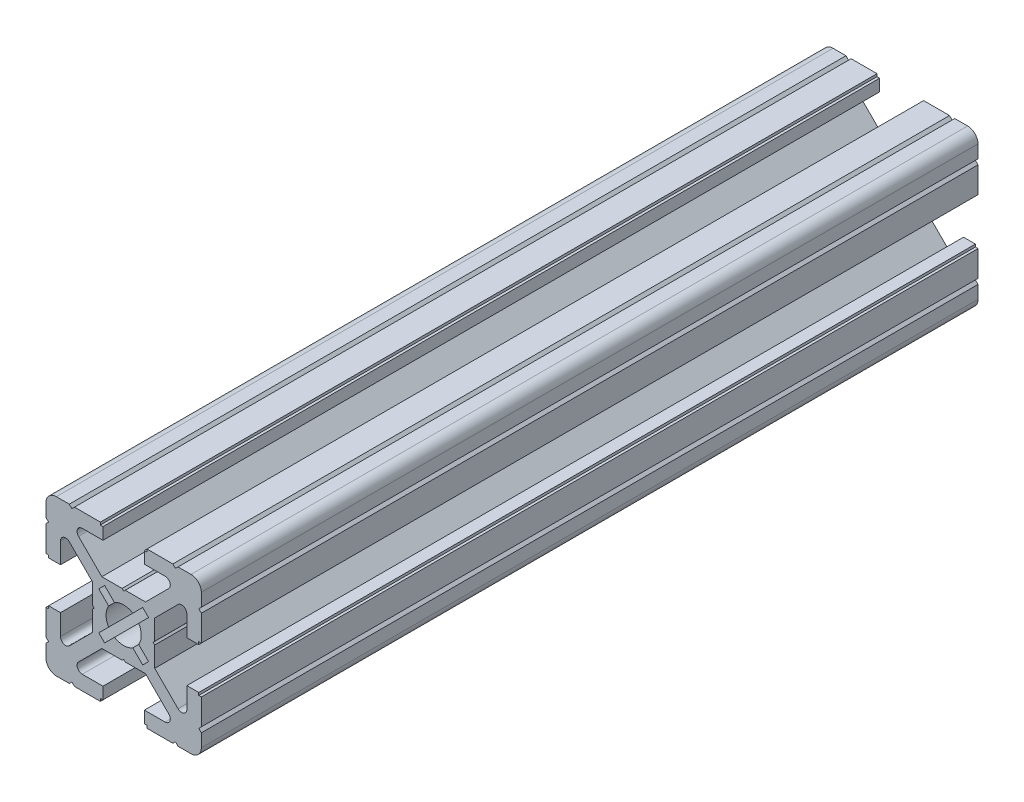
from build123d import *

# Parameters (mm, degrees)
BOSS_EXTRUDE1_DEPTH = 150


with BuildPart() as part:
    # Sketch1 → Boss-Extrude1 (new body)
    with BuildSketch(Plane.XY):
        with BuildLine():
            Line((12.999999999, 14.999999999), (10.499999999, 14.999999999))
            Line((10.499999999, 14.999999999), (9.999999999, 14.499999999))
            Line((9.999999999, 14.499999999), (9.5, 14.999999999))
            Line((9.5, 14.999999999), (4.5, 14.999999999))
            Line((4.5, 14.999999999), (4.5, 14.5))
            Line((4.5, 14.5), (4, 14.5))
            Line((4, 14.5), (4, 12.200000005))
            Line((4, 12.200000005), (7.999999994, 12.200000005))
            ThreePointArc((7.999999994, 12.200000005), (8.923879532, 11.582683434), (8.707106779, 10.492893215))
            Line((8.707106779, 10.492893215), (4.214213564, 6))
            Line((4.214213564, 6), (0.312520901, 6))
            Line((0.312520901, 6), (0, 5.7))
            Line((0, 5.7), (-0.312520903, 6))
            Line((-0.312520903, 6), (-4.214213564, 6))
            Line((-4.214213564, 6), (-8.70710678, 10.492893215))
            ThreePointArc((-8.70710678, 10.492893215), (-8.923879532, 11.582683434), (-7.999999995, 12.200000005))
            Line((-7.999999995, 12.200000005), (-4, 12.200000005))
            Line((-4, 12.200000005), (-4, 14.5))
            Line((-4, 14.5), (-4.5, 14.5))
            Line((-4.5, 14.5), (-4.5, 14.999999999))
            Line((-4.5, 14.999999999), (-9.500000003, 14.999999999))
            Line((-9.500000003, 14.999999999), (-10.000000002, 14.499999999))
            Line((-10.000000002, 14.499999999), (-10.500000001, 14.999999999))
            Line((-10.500000001, 14.999999999), (-13, 14.999999999))
            ThreePointArc((-13, 14.999999999), (-14.414213562, 14.414213561), (-15, 12.999999999))
            Line((-15, 12.999999999), (-15, 10.5))
            Line((-15, 10.5), (-14.500000001, 10.000000001))
            Line((-14.500000001, 10.000000001), (-15, 9.500000001))
            Line((-15, 9.500000001), (-15, 4.5))
            Line((-15, 4.5), (-14.5, 4.5))
            Line((-14.5, 4.5), (-14.5, 4))
            Line((-14.5, 4), (-12.200000005, 4))
            Line((-12.200000005, 4), (-12.200000005, 7.999999994))
            ThreePointArc((-12.200000005, 7.999999994), (-11.582683434, 8.923879532), (-10.492893215, 8.707106779))
            Line((-10.492893215, 8.707106779), (-6, 4.214213564))
            Line((-6, 4.214213564), (-6, 0.312520901))
            Line((-6, 0.312520901), (-5.7, 0))
            Line((-5.7, 0), (-6, -0.312520903))
            Line((-6, -0.312520903), (-6, -4.214213564))
            Line((-6, -4.214213564), (-10.492893215, -8.70710678))
            ThreePointArc((-10.492893215, -8.70710678), (-11.582683434, -8.923879532), (-12.200000005, -7.999999995))
            Line((-12.200000005, -7.999999995), (-12.200000005, -4))
            Line((-12.200000005, -4), (-14.5, -4))
            Line((-14.5, -4), (-14.5, -4.5))
            Line((-14.5, -4.5), (-15, -4.5))
            Line((-15, -4.5), (-15, -9.500000001))
            Line((-15, -9.500000001), (-14.500000001, -10.000000001))
            Line((-14.500000001, -10.000000001), (-15, -10.5))
            Line((-15, -10.5), (-15, -13))
            ThreePointArc((-15, -13), (-14.414213562, -14.414213562), (-13, -15))
            Line((-13, -15), (-10.489897949, -15))
            Line((-10.489897949, -15), (-9.989897949, -14.5))
            Line((-9.989897949, -14.5), (-9.500000001, -15))
            Line((-9.500000001, -15), (-4.5, -15))
            Line((-4.5, -15), (-4.5, -14.5))
            Line((-4.5, -14.5), (-4, -14.5))
            Line((-4, -14.5), (-4, -12.200000005))
            Line((-4, -12.200000005), (-7.999999995, -12.200000005))
            ThreePointArc((-7.999999995, -12.200000005), (-8.923879532, -11.582683434), (-8.70710678, -10.492893215))
            Line((-8.70710678, -10.492893215), (-4.214213564, -6))
            Line((-4.214213564, -6), (-0.312520901, -6))
            Line((-0.312520901, -6), (0, -5.7))
            Line((0, -5.7), (0.312520903, -6))
            Line((0.312520903, -6), (4.214213564, -6))
            Line((4.214213564, -6), (8.70710678, -10.492893215))
            ThreePointArc((8.70710678, -10.492893215), (8.923879532, -11.582683434), (7.999999995, -12.200000005))
            Line((7.999999995, -12.200000005), (4, -12.200000005))
            Line((4, -12.200000005), (4, -14.5))
            Line((4, -14.5), (4.5, -14.5))
            Line((4.5, -14.5), (4.5, -15))
            Line((4.5, -15), (9.500000001, -15))
            Line((9.500000001, -15), (10.000000001, -14.500000001))
            Line((10.000000001, -14.500000001), (10.5, -15))
            Line((10.5, -15), (12.999999999, -15))
            ThreePointArc((12.999999999, -15), (14.414213561, -14.414213562), (14.999999999, -13))
            Line((14.999999999, -13), (14.999999999, -10.500000001))
            Line((14.999999999, -10.500000001), (14.499999999, -10.000000002))
            Line((14.499999999, -10.000000002), (14.999999999, -9.500000002))
            Line((14.999999999, -9.500000002), (14.999999999, -4.5))
            Line((14.999999999, -4.5), (14.5, -4.5))
            Line((14.5, -4.5), (14.5, -4))
            Line((14.5, -4), (12.200000005, -4))
            Line((12.200000005, -4), (12.200000005, -7.999999995))
            ThreePointArc((12.200000005, -7.999999995), (11.582683434, -8.923879532), (10.492893215, -8.70710678))
            Line((10.492893215, -8.70710678), (6, -4.214213564))
            Line((6, -4.214213564), (6, -0.312520901))
            Line((6, -0.312520901), (5.7, 0))
            Line((5.7, 0), (6, 0.312520903))
            Line((6, 0.312520903), (6, 4.214213564))
            Line((6, 4.214213564), (10.492893215, 8.70710678))
            ThreePointArc((10.492893215, 8.70710678), (11.582683434, 8.923879532), (12.200000005, 7.999999995))
            Line((12.200000005, 7.999999995), (12.200000005, 4))
            Line((12.200000005, 4), (14.5, 4))
            Line((14.5, 4), (14.5, 4.5))
            Line((14.5, 4.5), (14.999999999, 4.5))
            Line((14.999999999, 4.5), (14.999999999, 9.5))
            Line((14.999999999, 9.5), (14.499999999, 9.999999999))
            Line((14.499999999, 9.999999999), (14.999999999, 10.499999999))
            Line((14.999999999, 10.499999999), (14.999999999, 12.999999999))
            ThreePointArc((14.999999999, 12.999999999), (14.414213561, 14.414213561), (12.999999999, 14.999999999))
        make_face()
        with BuildLine():
            Line((-2.902349714, 1.770978864), (-4.808326112, 3.676955262))
            Line((-4.808326112, 3.676955262), (-3.676955262, 4.808326112))
            Line((-3.676955262, 4.808326112), (-1.770978864, 2.902349714))
            ThreePointArc((-1.770978864, 2.902349714), (0, 3.4), (1.770978864, 2.902349714))
            Line((1.770978864, 2.902349714), (3.676955262, 4.808326112))
            Line((3.676955262, 4.808326112), (4.808326112, 3.676955262))
            Line((4.808326112, 3.676955262), (2.902349714, 1.770978864))
            ThreePointArc((2.902349714, 1.770978864), (3.4, 0), (2.902349714, -1.770978864))
            Line((2.902349714, -1.770978864), (4.808326112, -3.676955262))
            Line((4.808326112, -3.676955262), (3.676955262, -4.808326112))
            Line((3.676955262, -4.808326112), (1.770978864, -2.902349714))
            ThreePointArc((1.770978864, -2.902349714), (0, -3.4), (-1.770978864, -2.902349714))
            Line((-1.770978864, -2.902349714), (-3.676955262, -4.808326112))
            Line((-3.676955262, -4.808326112), (-4.808326112, -3.676955262))
            Line((-4.808326112, -3.676955262), (-2.902349714, -1.770978864))
            ThreePointArc((-2.902349714, -1.770978864), (-3.4, 0), (-2.902349714, 1.770978864))
        make_face(mode=Mode.SUBTRACT)
    extrude(amount=BOSS_EXTRUDE1_DEPTH)


solid = part.part
